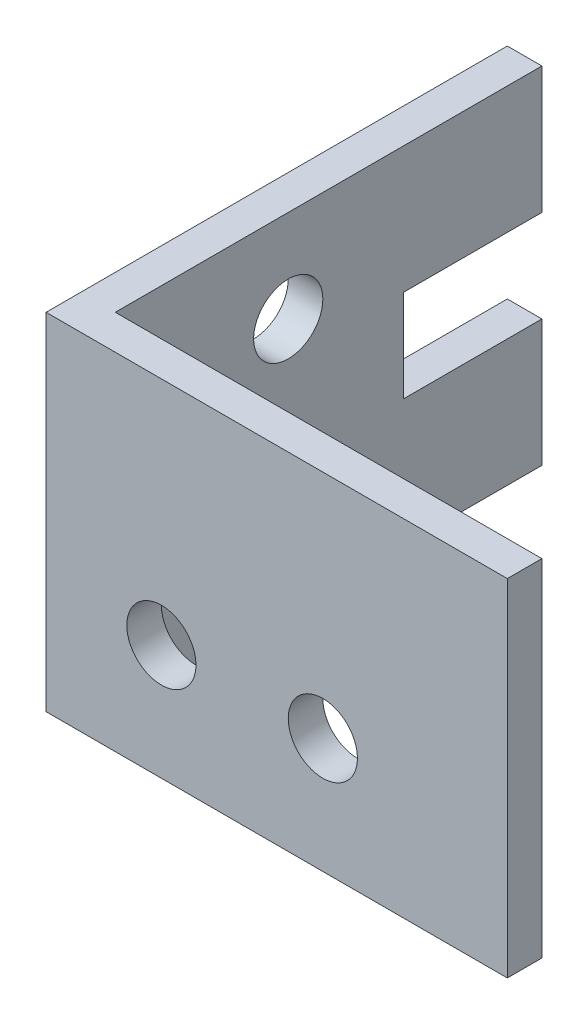
from build123d import *

# Parameters (mm, degrees)
EXTRUSION1_DEPTH = 15
ESQUISSE3_R      = 1.5
EXTRUSION2_DEPTH = 40
ESQUISSE5_R      = 1.5
ESQUISSE5_W      = 7
ESQUISSE5_H      = 4
EXTRUSION3_DEPTH = 40


with BuildPart() as part:
    # Esquisse1 → Extrusion1 (new body)
    with BuildSketch(Plane(origin=(0, 0, 0), x_dir=(1, 0, 0), z_dir=(0, 1, 0))):
        Polygon((5.12562835, -15.59067149), (-14.87437165, -15.59067149), (-14.87437165, 4.40932851), (-13.37437165, 4.40932851), (-13.37437165, -14.09067149), (5.12562835, -14.09067149), align=None)
    extrude(amount=EXTRUSION1_DEPTH)

    # Esquisse3 → Extrusion2 (cut)
    with BuildSketch(Plane(origin=(0, 0, 14.09067149), x_dir=(-1, 0, 0), z_dir=(0, 0, -1))):
        with Locations((2.87437165, 5)):
            Circle(ESQUISSE3_R)
        with Locations((9.87437165, 5)):
            Circle(ESQUISSE3_R)
    extrude(amount=-EXTRUSION2_DEPTH, mode=Mode.SUBTRACT)

    # Esquisse5 → Extrusion3 (cut)
    with BuildSketch(Plane(origin=(-13.37437165, 0, 0), x_dir=(0, 0, -1), z_dir=(1, 0, 0))):
        with Locations((-6.59067149, 4)):
            Circle(ESQUISSE5_R)
        with Locations((-6.59067149, 11)):
            Circle(ESQUISSE5_R)
        with Locations((1.90932851, 7.5)):
            Rectangle(ESQUISSE5_W, ESQUISSE5_H)
    extrude(amount=-EXTRUSION3_DEPTH, mode=Mode.SUBTRACT)


solid = part.part
